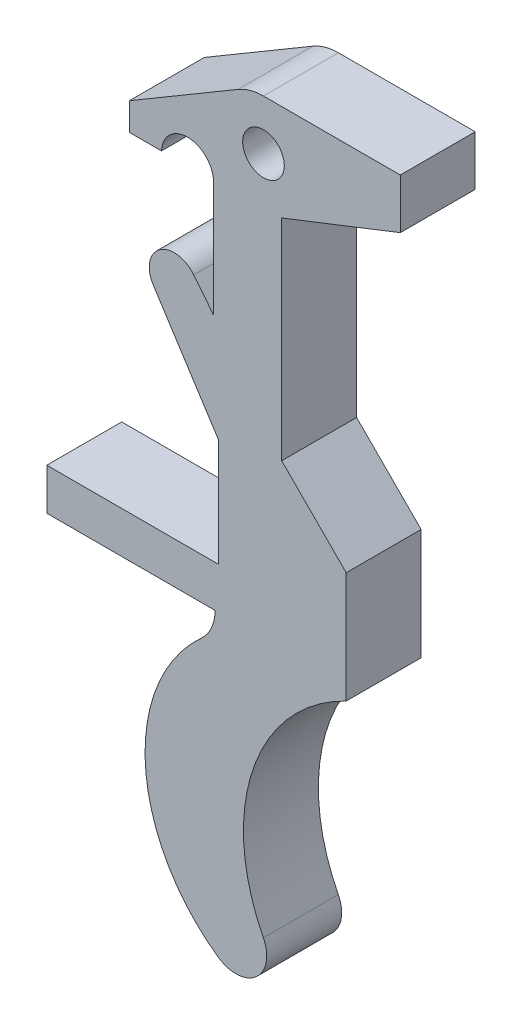
from build123d import *

# Parameters (mm, degrees)
SKETCH_1_R      = 6
SKETCH_1_R_2    = 2.5
EXTRUDE_1_DEPTH = 9


with BuildPart() as part:
    # 스케치1 → 보스-돌출1 (new body)
    # profile 1 of 4: a face of its own
    with BuildSketch(Plane.XY):
        with BuildLine():
            ThreePointArc((-6, 0), (-5.210442588, 2.975111433), (-3.049570653, 5.167215772))
            Line((-3.049570653, 5.167215772), (-16.111090591, -2.541389723))
            Line((-16.111090591, -2.541389723), (-16.111090591, -5.836943755))
            Line((-16.111090591, -5.836943755), (-12.250201934, -5.836943755))
            ThreePointArc((-12.250201934, -5.836943755), (-9.126567796, -2.835740329), (-6, -5.833887432))
            Line((-6, -5.833887432), (-6, 0))
        make_face()
    # profile 2 of 4: a face of its own
    with BuildSketch(Plane.XY):
        with BuildLine():
            Line((16.434621945, 6), (0, 6))
            ThreePointArc((0, 6), (4.242640687, 4.242640687), (6, 0))
            ThreePointArc((6, 0), (4.956964072, -3.380607517), (2.190497604, -5.585850002))
            Line((2.190497604, -5.585850002), (16.434621945, 0))
            Line((16.434621945, 0), (16.434621945, 6))
        make_face()
    # profile 3 of 4: a face of its own
    with BuildSketch(Plane.XY):
        Circle(SKETCH_1_R)
        Circle(SKETCH_1_R_2, mode=Mode.SUBTRACT)
    # profile 4 of 4: a face of its own
    with BuildSketch(Plane.XY):
        with BuildLine():
            Line((2.190497604, -30.847252926), (2.190497604, -5.585850002))
            ThreePointArc((2.190497604, -5.585850002), (-3.380607517, -4.956964072), (-6, 0))
            Line((-6, 0), (-6, -5.833887432))
            Line((-6, -5.833887432), (-6, -19.780443195))
            Line((-6, -19.780443195), (-8.3707384, -16.792476109))
            ThreePointArc((-8.3707384, -16.792476109), (-10.302632743, -15.686424516), (-12.464810398, -16.216097687))
            ThreePointArc((-12.464810398, -16.216097687), (-13.667159153, -18.09204707), (-13.244188655, -20.27972268))
            Line((-13.244188655, -20.27972268), (-5.421227317, -32.445374533))
            Line((-5.421227317, -32.445374533), (-5.421227317, -45.420304836))
            Line((-5.421227317, -45.420304836), (-10.815978179, -45.420304836))
            Line((-10.815978179, -45.420304836), (-26.029458153, -45.420304836))
            Line((-26.029458153, -45.420304836), (-26.029458153, -50.420304836))
            Line((-26.029458153, -50.420304836), (-5.815978179, -50.420304836))
            ThreePointArc((-5.815978179, -50.420304836), (-6.244398475, -52.445313233), (-7.456241783, -54.123299752))
            ThreePointArc((-7.456241783, -54.123299752), (-14.186407072, -70.69683465), (-5.442779998, -86.302159685))
            ThreePointArc((-5.442779998, -86.302159685), (-0.881190338, -86.064944821), (-0.013072775, -81.580444512))
            ThreePointArc((-0.013072775, -81.580444512), (-1.268243927, -64.682757564), (9.939607459, -51.974833024))
            Line((9.939607459, -51.974833024), (9.939607459, -38.622486351))
            Line((9.939607459, -38.622486351), (2.190497604, -30.847252926))
        make_face()
    extrude(amount=EXTRUDE_1_DEPTH)


solid = part.part
